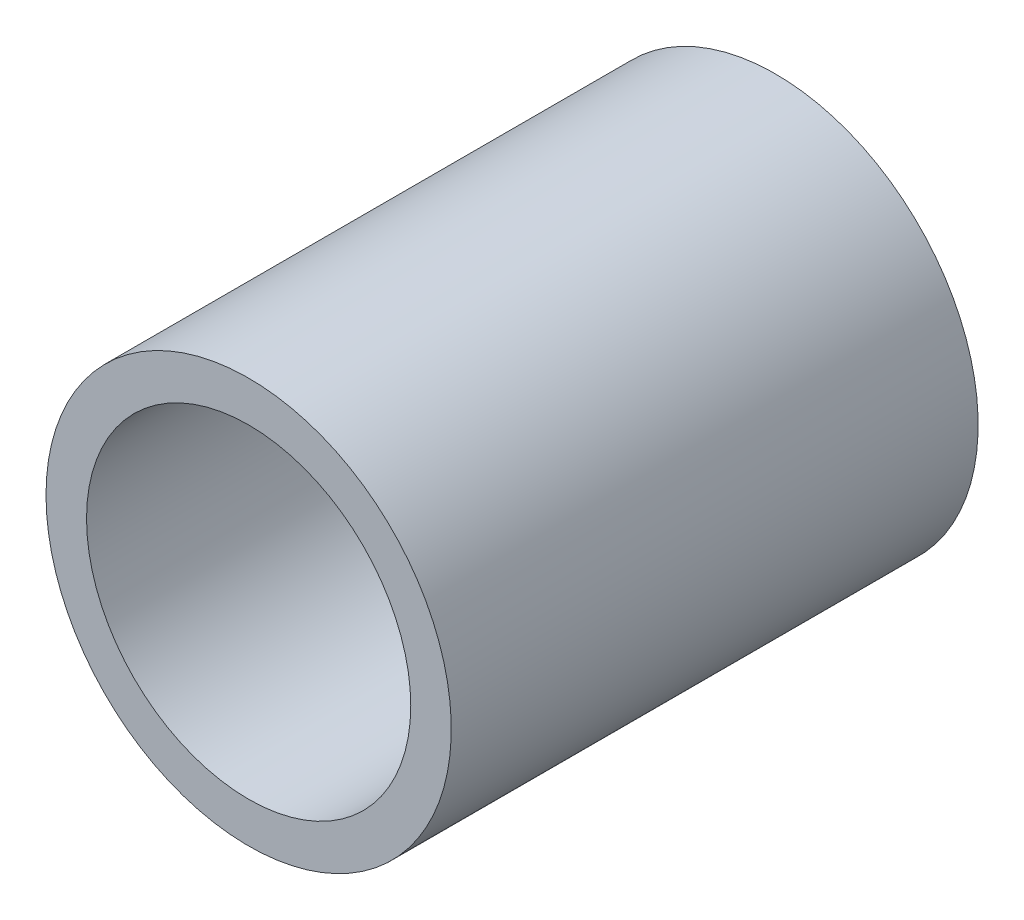
from build123d import *

# Parameters (mm, degrees)
ESQUISSE1_R        = 4
BOSS_EXTRU_1_DEPTH = 13
COQUE1_T           = 1


with BuildPart() as part:
    # Esquisse1 → Boss.-Extru.1 (new body)
    with BuildSketch(Plane.XY):
        with Locations(Location((0, 0, 0), (0, 0, 180))):
            Circle(ESQUISSE1_R)
    extrude(amount=BOSS_EXTRU_1_DEPTH)

    # Coque1
    coque1_openings = [part.faces().sort_by_distance(p)[0] for p in [
        (0, 0, 0),
        (0, 0, 13),
    ]]
    offset(amount=COQUE1_T, openings=coque1_openings, kind=Kind.INTERSECTION)


solid = part.part
